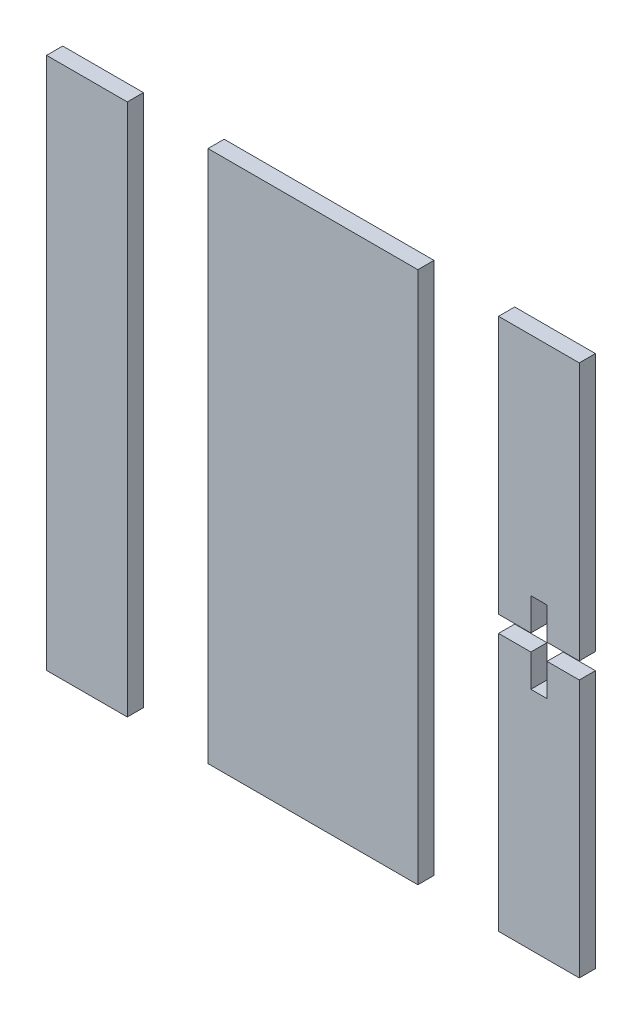
from build123d import *

# Parameters (mm, degrees)
SKETCH1_W             = 0.5
SKETCH1_H             = 3.3
BOSS_EXTRUDE1_DEPTH   = 0.1
SKETCH1_W_2           = 1.3
BOSS_EXTRUDE1_2_DEPTH = 0.1
BOSS_EXTRUDE1_3_DEPTH = 0.1
CUT_EXTRUDE1_DEPTH    = 5.755258755


with BuildPart() as part:
    # Sketch1 → Boss-Extrude1 (new body)
    with BuildSketch(Plane.XY):
        with Locations((0.484957257, 1.529082104)):
            Rectangle(SKETCH1_W, SKETCH1_H)
    extrude(amount=BOSS_EXTRUDE1_DEPTH)


with BuildPart() as body_2:
    # Sketch1 → Boss-Extrude1 2 (new body)
    with BuildSketch(Plane.XY):
        with Locations((1.884957257, 1.529082104)):
            Rectangle(SKETCH1_W_2, SKETCH1_H)
    extrude(amount=BOSS_EXTRUDE1_2_DEPTH)


with BuildPart() as body_3:
    # Sketch1 → Boss-Extrude1 3 (new body)
    with BuildSketch(Plane.XY):
        with Locations((3.284957257, 1.529082104)):
            Rectangle(SKETCH1_W, SKETCH1_H)
    extrude(amount=BOSS_EXTRUDE1_3_DEPTH)

    # Sketch3 → Cut-Extrude1 (cut, through all)
    with BuildSketch(Plane.XY.offset(0.1)):
        Polygon((3.034957257, 1.58020971), (3.234957257, 1.58020971), (3.234957257, 1.78020971), (3.334957257, 1.78020971), (3.334957257, 1.58020971), (3.534957257, 1.58020971), (3.534957257, 1.477954497), (3.334957257, 1.477954497), (3.334957257, 1.277954497), (3.234957257, 1.277954497), (3.234957257, 1.477954497), (3.034957257, 1.477954497), align=None)
    extrude(amount=-CUT_EXTRUDE1_DEPTH, mode=Mode.SUBTRACT)


with BuildPart() as cut_extrude1_piece_1:
    # of the separate pieces the step leaves, piece 1, a body of its own (cut_extrude1_pieces)
    add(body_3.part.solids().sort_by_distance((3.534957257, 3.179082104, 0))[0])


with BuildPart() as cut_extrude1_piece_2:
    # of the separate pieces the step leaves, piece 2, a body of its own (cut_extrude1_pieces)
    add(body_3.part.solids().sort_by_distance((3.534957257, 1.477954497, 0))[0])


solid = Compound([part.part, body_2.part, cut_extrude1_piece_1.part, cut_extrude1_piece_2.part])
